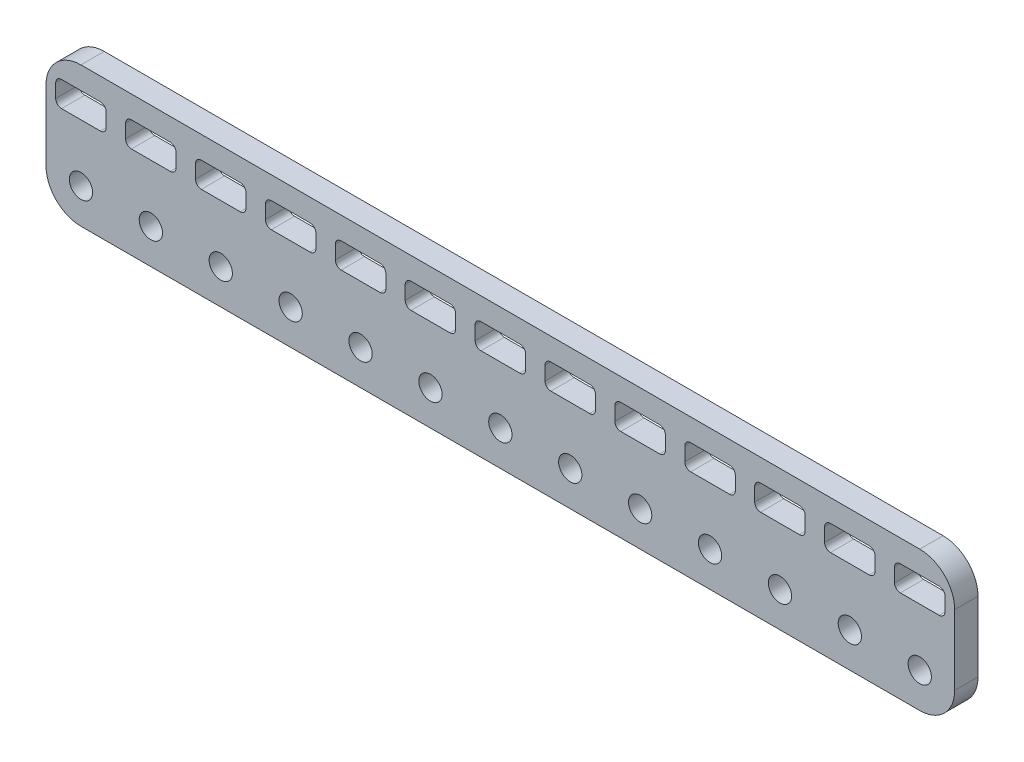
from build123d import *

# Parameters (mm, degrees)
MODEL_R                 = 1.5
SALIENTE_EXTRUIR1_DEPTH = 3


with BuildPart() as part:
    # Model → Saliente-Extruir1 (new body)
    with BuildSketch(Plane.XY):
        with BuildLine():
            Line((256.429131311, 228.742243614), (364.429131311, 228.742243614))
            ThreePointArc((364.429131311, 228.742243614), (367.611111826, 227.424224129), (368.929131311, 224.242243614))
            Line((368.929131311, 224.242243614), (368.929131311, 215.242243614))
            ThreePointArc((368.929131311, 215.242243614), (367.611111826, 212.060263099), (364.429131311, 210.742243614))
            Line((364.429131311, 210.742243614), (256.429131311, 210.742243614))
            ThreePointArc((256.429131311, 210.742243614), (253.247150795, 212.060263099), (251.929131311, 215.242243614))
            Line((251.929131311, 215.242243614), (251.929131311, 224.242243614))
            ThreePointArc((251.929131311, 224.242243614), (253.247150795, 227.424224129), (256.429131311, 228.742243614))
        make_face()
        with Locations((337.429131311, 215.242243614)):
            Circle(MODEL_R, mode=Mode.SUBTRACT)
        with Locations((319.429131311, 215.242243614)):
            Circle(MODEL_R, mode=Mode.SUBTRACT)
        with Locations((328.429131311, 215.242243614)):
            Circle(MODEL_R, mode=Mode.SUBTRACT)
        with Locations((310.429131311, 215.242243614)):
            Circle(MODEL_R, mode=Mode.SUBTRACT)
        with Locations((292.429131311, 215.242243614)):
            Circle(MODEL_R, mode=Mode.SUBTRACT)
        with Locations((301.429131311, 215.242243614)):
            Circle(MODEL_R, mode=Mode.SUBTRACT)
        with Locations((274.429131311, 215.242243614)):
            Circle(MODEL_R, mode=Mode.SUBTRACT)
        with Locations((283.429131311, 215.242243614)):
            Circle(MODEL_R, mode=Mode.SUBTRACT)
        with Locations((265.429131311, 215.242243614)):
            Circle(MODEL_R, mode=Mode.SUBTRACT)
        with Locations((256.429131311, 215.242243614)):
            Circle(MODEL_R, mode=Mode.SUBTRACT)
        with Locations((346.429131311, 215.242243614)):
            Circle(MODEL_R, mode=Mode.SUBTRACT)
        with Locations((355.429131311, 215.242243614)):
            Circle(MODEL_R, mode=Mode.SUBTRACT)
        with Locations((364.429131311, 215.242243614)):
            Circle(MODEL_R, mode=Mode.SUBTRACT)
        with BuildLine():
            Line((267.929131311, 222.617243614), (262.929131311, 222.617243614))
            ThreePointArc((262.929131311, 222.617243614), (262.398801225, 222.836913528), (262.179131311, 223.367243614))
            Line((262.179131311, 223.367243614), (262.179131311, 225.117243614))
            ThreePointArc((262.179131311, 225.117243614), (262.398801225, 225.6475737), (262.929131311, 225.867243614))
            Line((262.929131311, 225.867243614), (267.929131311, 225.867243614))
            ThreePointArc((267.929131311, 225.867243614), (268.459461397, 225.6475737), (268.679131311, 225.117243614))
            Line((268.679131311, 225.117243614), (268.679131311, 223.367243614))
            ThreePointArc((268.679131311, 223.367243614), (268.459461397, 222.836913528), (267.929131311, 222.617243614))
        make_face(mode=Mode.SUBTRACT)
        with BuildLine():
            Line((285.929131311, 222.617243614), (280.929131311, 222.617243614))
            ThreePointArc((280.929131311, 222.617243614), (280.398801225, 222.836913528), (280.179131311, 223.367243614))
            Line((280.179131311, 223.367243614), (280.179131311, 225.117243614))
            ThreePointArc((280.179131311, 225.117243614), (280.398801225, 225.6475737), (280.929131311, 225.867243614))
            Line((280.929131311, 225.867243614), (285.929131311, 225.867243614))
            ThreePointArc((285.929131311, 225.867243614), (286.459461397, 225.6475737), (286.679131311, 225.117243614))
            Line((286.679131311, 225.117243614), (286.679131311, 223.367243614))
            ThreePointArc((286.679131311, 223.367243614), (286.459461397, 222.836913528), (285.929131311, 222.617243614))
        make_face(mode=Mode.SUBTRACT)
        with BuildLine():
            Line((258.929131311, 222.617243614), (253.929131311, 222.617243614))
            ThreePointArc((253.929131311, 222.617243614), (253.398801225, 222.836913528), (253.179131311, 223.367243614))
            Line((253.179131311, 223.367243614), (253.179131311, 225.117243614))
            ThreePointArc((253.179131311, 225.117243614), (253.398801225, 225.6475737), (253.929131311, 225.867243614))
            Line((253.929131311, 225.867243614), (258.929131311, 225.867243614))
            ThreePointArc((258.929131311, 225.867243614), (259.459461397, 225.6475737), (259.679131311, 225.117243614))
            Line((259.679131311, 225.117243614), (259.679131311, 223.367243614))
            ThreePointArc((259.679131311, 223.367243614), (259.459461397, 222.836913528), (258.929131311, 222.617243614))
        make_face(mode=Mode.SUBTRACT)
        with BuildLine():
            Line((276.929131311, 222.617243614), (271.929131311, 222.617243614))
            ThreePointArc((271.929131311, 222.617243614), (271.398801225, 222.836913528), (271.179131311, 223.367243614))
            Line((271.179131311, 223.367243614), (271.179131311, 225.117243614))
            ThreePointArc((271.179131311, 225.117243614), (271.398801225, 225.6475737), (271.929131311, 225.867243614))
            Line((271.929131311, 225.867243614), (276.929131311, 225.867243614))
            ThreePointArc((276.929131311, 225.867243614), (277.459461397, 225.6475737), (277.679131311, 225.117243614))
            Line((277.679131311, 225.117243614), (277.679131311, 223.367243614))
            ThreePointArc((277.679131311, 223.367243614), (277.459461397, 222.836913528), (276.929131311, 222.617243614))
        make_face(mode=Mode.SUBTRACT)
        with BuildLine():
            Line((294.929131311, 222.617243614), (289.929131311, 222.617243614))
            ThreePointArc((289.929131311, 222.617243614), (289.398801225, 222.836913528), (289.179131311, 223.367243614))
            Line((289.179131311, 223.367243614), (289.179131311, 225.117243614))
            ThreePointArc((289.179131311, 225.117243614), (289.398801225, 225.6475737), (289.929131311, 225.867243614))
            Line((289.929131311, 225.867243614), (294.929131311, 225.867243614))
            ThreePointArc((294.929131311, 225.867243614), (295.459461397, 225.6475737), (295.679131311, 225.117243614))
            Line((295.679131311, 225.117243614), (295.679131311, 223.367243614))
            ThreePointArc((295.679131311, 223.367243614), (295.459461397, 222.836913528), (294.929131311, 222.617243614))
        make_face(mode=Mode.SUBTRACT)
        with BuildLine():
            Line((303.929131311, 222.617243614), (298.929131311, 222.617243614))
            ThreePointArc((298.929131311, 222.617243614), (298.398801225, 222.836913528), (298.179131311, 223.367243614))
            Line((298.179131311, 223.367243614), (298.179131311, 225.117243614))
            ThreePointArc((298.179131311, 225.117243614), (298.398801225, 225.6475737), (298.929131311, 225.867243614))
            Line((298.929131311, 225.867243614), (303.929131311, 225.867243614))
            ThreePointArc((303.929131311, 225.867243614), (304.459461397, 225.6475737), (304.679131311, 225.117243614))
            Line((304.679131311, 225.117243614), (304.679131311, 223.367243614))
            ThreePointArc((304.679131311, 223.367243614), (304.459461397, 222.836913528), (303.929131311, 222.617243614))
        make_face(mode=Mode.SUBTRACT)
        with BuildLine():
            Line((321.929131311, 222.617243614), (316.929131311, 222.617243614))
            ThreePointArc((316.929131311, 222.617243614), (316.398801225, 222.836913528), (316.179131311, 223.367243614))
            Line((316.179131311, 223.367243614), (316.179131311, 225.117243614))
            ThreePointArc((316.179131311, 225.117243614), (316.398801225, 225.6475737), (316.929131311, 225.867243614))
            Line((316.929131311, 225.867243614), (321.929131311, 225.867243614))
            ThreePointArc((321.929131311, 225.867243614), (322.459461397, 225.6475737), (322.679131311, 225.117243614))
            Line((322.679131311, 225.117243614), (322.679131311, 223.367243614))
            ThreePointArc((322.679131311, 223.367243614), (322.459461397, 222.836913528), (321.929131311, 222.617243614))
        make_face(mode=Mode.SUBTRACT)
        with BuildLine():
            Line((312.929131311, 222.617243614), (307.929131311, 222.617243614))
            ThreePointArc((307.929131311, 222.617243614), (307.398801225, 222.836913528), (307.179131311, 223.367243614))
            Line((307.179131311, 223.367243614), (307.179131311, 225.117243614))
            ThreePointArc((307.179131311, 225.117243614), (307.398801225, 225.6475737), (307.929131311, 225.867243614))
            Line((307.929131311, 225.867243614), (312.929131311, 225.867243614))
            ThreePointArc((312.929131311, 225.867243614), (313.459461397, 225.6475737), (313.679131311, 225.117243614))
            Line((313.679131311, 225.117243614), (313.679131311, 223.367243614))
            ThreePointArc((313.679131311, 223.367243614), (313.459461397, 222.836913528), (312.929131311, 222.617243614))
        make_face(mode=Mode.SUBTRACT)
        with BuildLine():
            Line((357.929131311, 222.617243614), (352.929131311, 222.617243614))
            ThreePointArc((352.929131311, 222.617243614), (352.398801225, 222.836913528), (352.179131311, 223.367243614))
            Line((352.179131311, 223.367243614), (352.179131311, 225.117243614))
            ThreePointArc((352.179131311, 225.117243614), (352.398801225, 225.6475737), (352.929131311, 225.867243614))
            Line((352.929131311, 225.867243614), (357.929131311, 225.867243614))
            ThreePointArc((357.929131311, 225.867243614), (358.459461397, 225.6475737), (358.679131311, 225.117243614))
            Line((358.679131311, 225.117243614), (358.679131311, 223.367243614))
            ThreePointArc((358.679131311, 223.367243614), (358.459461397, 222.836913528), (357.929131311, 222.617243614))
        make_face(mode=Mode.SUBTRACT)
        with BuildLine():
            Line((348.929131311, 222.617243614), (343.929131311, 222.617243614))
            ThreePointArc((343.929131311, 222.617243614), (343.398801225, 222.836913528), (343.179131311, 223.367243614))
            Line((343.179131311, 223.367243614), (343.179131311, 225.117243614))
            ThreePointArc((343.179131311, 225.117243614), (343.398801225, 225.6475737), (343.929131311, 225.867243614))
            Line((343.929131311, 225.867243614), (348.929131311, 225.867243614))
            ThreePointArc((348.929131311, 225.867243614), (349.459461397, 225.6475737), (349.679131311, 225.117243614))
            Line((349.679131311, 225.117243614), (349.679131311, 223.367243614))
            ThreePointArc((349.679131311, 223.367243614), (349.459461397, 222.836913528), (348.929131311, 222.617243614))
        make_face(mode=Mode.SUBTRACT)
        with BuildLine():
            Line((339.929131311, 222.617243614), (334.929131311, 222.617243614))
            ThreePointArc((334.929131311, 222.617243614), (334.398801225, 222.836913528), (334.179131311, 223.367243614))
            Line((334.179131311, 223.367243614), (334.179131311, 225.117243614))
            ThreePointArc((334.179131311, 225.117243614), (334.398801225, 225.6475737), (334.929131311, 225.867243614))
            Line((334.929131311, 225.867243614), (339.929131311, 225.867243614))
            ThreePointArc((339.929131311, 225.867243614), (340.459461397, 225.6475737), (340.679131311, 225.117243614))
            Line((340.679131311, 225.117243614), (340.679131311, 223.367243614))
            ThreePointArc((340.679131311, 223.367243614), (340.459461397, 222.836913528), (339.929131311, 222.617243614))
        make_face(mode=Mode.SUBTRACT)
        with BuildLine():
            Line((330.929131311, 222.617243614), (325.929131311, 222.617243614))
            ThreePointArc((325.929131311, 222.617243614), (325.398801225, 222.836913528), (325.179131311, 223.367243614))
            Line((325.179131311, 223.367243614), (325.179131311, 225.117243614))
            ThreePointArc((325.179131311, 225.117243614), (325.398801225, 225.6475737), (325.929131311, 225.867243614))
            Line((325.929131311, 225.867243614), (330.929131311, 225.867243614))
            ThreePointArc((330.929131311, 225.867243614), (331.459461397, 225.6475737), (331.679131311, 225.117243614))
            Line((331.679131311, 225.117243614), (331.679131311, 223.367243614))
            ThreePointArc((331.679131311, 223.367243614), (331.459461397, 222.836913528), (330.929131311, 222.617243614))
        make_face(mode=Mode.SUBTRACT)
        with BuildLine():
            Line((366.929131311, 222.617243614), (361.929131311, 222.617243614))
            ThreePointArc((361.929131311, 222.617243614), (361.398801225, 222.836913528), (361.179131311, 223.367243614))
            Line((361.179131311, 223.367243614), (361.179131311, 225.117243614))
            ThreePointArc((361.179131311, 225.117243614), (361.398801225, 225.6475737), (361.929131311, 225.867243614))
            Line((361.929131311, 225.867243614), (366.929131311, 225.867243614))
            ThreePointArc((366.929131311, 225.867243614), (367.459461397, 225.6475737), (367.679131311, 225.117243614))
            Line((367.679131311, 225.117243614), (367.679131311, 223.367243614))
            ThreePointArc((367.679131311, 223.367243614), (367.459461397, 222.836913528), (366.929131311, 222.617243614))
        make_face(mode=Mode.SUBTRACT)
    extrude(amount=SALIENTE_EXTRUIR1_DEPTH)


solid = part.part
